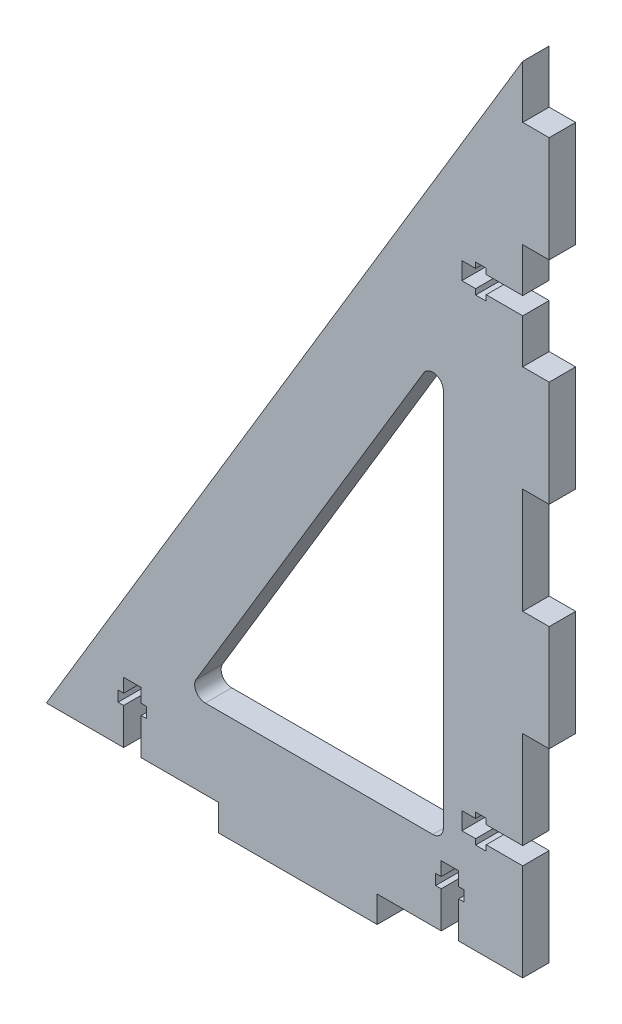
from build123d import *

# Parameters (mm, degrees)
BOSS_EXTRUDE1_DEPTH = 3.175
CUT_EXTRUDE1_DEPTH  = 223.25
SKETCH4_W           = 6.35
SKETCH4_H           = 25.4
BOSS_EXTRUDE2_DEPTH = 6.35
LPATTERN1_COUNT     = 3
LPATTERN1_PITCH     = 50.8
SKETCH5_W           = 38.1
SKETCH5_H           = 6.35
BOSS_EXTRUDE3_DEPTH = 6.35
FILLET1_R           = 2.54
CUT_EXTRUDE2_DEPTH  = 6.35


with BuildPart() as part:
    # Sketch1 → Boss-Extrude1 (new, symmetric)
    with BuildSketch(Plane.XY):
        Polygon((0, 190.5), (0, 0), (-114.3, 0), align=None)
    extrude(amount=BOSS_EXTRUDE1_DEPTH, both=True)

    # Sketch2 → Cut-Extrude1 (cut, through all)
    with BuildSketch(Plane.XY.offset(3.175)):
        Polygon((-80.654073281, 19.05), (-19.05, 19.05), (-19.05, 121.723455468), align=None)
    extrude(amount=-CUT_EXTRUDE1_DEPTH, mode=Mode.SUBTRACT)

    # Sketch4 → Boss-Extrude2 (add)
    with BuildSketch(Plane(origin=(0, 0, 0), x_dir=(0, 0, -1), z_dir=(1, 0, 0))):
        with Locations((0, 165.1)):
            Rectangle(SKETCH4_W, SKETCH4_H)
    boss_extrude2 = extrude(amount=BOSS_EXTRUDE2_DEPTH)

    # LPattern1: Boss-Extrude2 ×3
    with Locations(*[(0, -i * LPATTERN1_PITCH, 0) for i in range(1, LPATTERN1_COUNT)]):
        add(boss_extrude2)

    # Sketch5 → Boss-Extrude3 (add)
    with BuildSketch(Plane(origin=(0, 0, 0), x_dir=(-1, 0, 0), z_dir=(0, -1, 0))):
        with Locations((53.975, 0)):
            Rectangle(SKETCH5_W, SKETCH5_H)
    extrude(amount=BOSS_EXTRUDE3_DEPTH)

    # Fillet1
    fillet1_edges = [part.edges().sort_by_distance(p)[0] for p in [
        (-80.654073281, 19.05, 0),
        (-19.05, 121.723455468, 0),
        (-19.05, 19.05, 0),
    ]]
    fillet(fillet1_edges, radius=FILLET1_R)

    # Sketch3 → Cut-Extrude2 (cut)
    with BuildSketch(Plane(origin=(0, 0, -3.175), x_dir=(-1, 0, 0), z_dir=(0, 0, -1))):
        Polygon((91.567, 0), (95.758, 0), (95.758, 8.763), (97.0915, 8.763), (97.0915, 11.303), (95.758, 11.303), (95.758, 14.605), (91.567, 14.605), (91.567, 11.303), (90.2335, 11.303), (90.2335, 8.763), (91.567, 8.763), align=None)
        Polygon((15.367, 0), (19.558, 0), (19.558, 8.763), (20.8915, 8.763), (20.8915, 11.303), (19.558, 11.303), (19.558, 14.605), (15.367, 14.605), (15.367, 11.303), (14.0335, 11.303), (14.0335, 8.763), (15.367, 8.763), align=None)
        Polygon((0, 141.7955), (0, 137.6045), (8.763, 137.6045), (8.763, 136.271), (11.303, 136.271), (11.303, 137.6045), (14.605, 137.6045), (14.605, 141.7955), (11.303, 141.7955), (11.303, 143.129), (8.763, 143.129), (8.763, 141.7955), align=None)
        Polygon((0, 27.4955), (0, 23.3045), (8.763, 23.3045), (8.763, 21.971), (11.303, 21.971), (11.303, 23.3045), (14.605, 23.3045), (14.605, 27.4955), (11.303, 27.4955), (11.303, 28.829), (8.763, 28.829), (8.763, 27.4955), align=None)
    extrude(amount=-CUT_EXTRUDE2_DEPTH, mode=Mode.SUBTRACT)


solid = part.part
